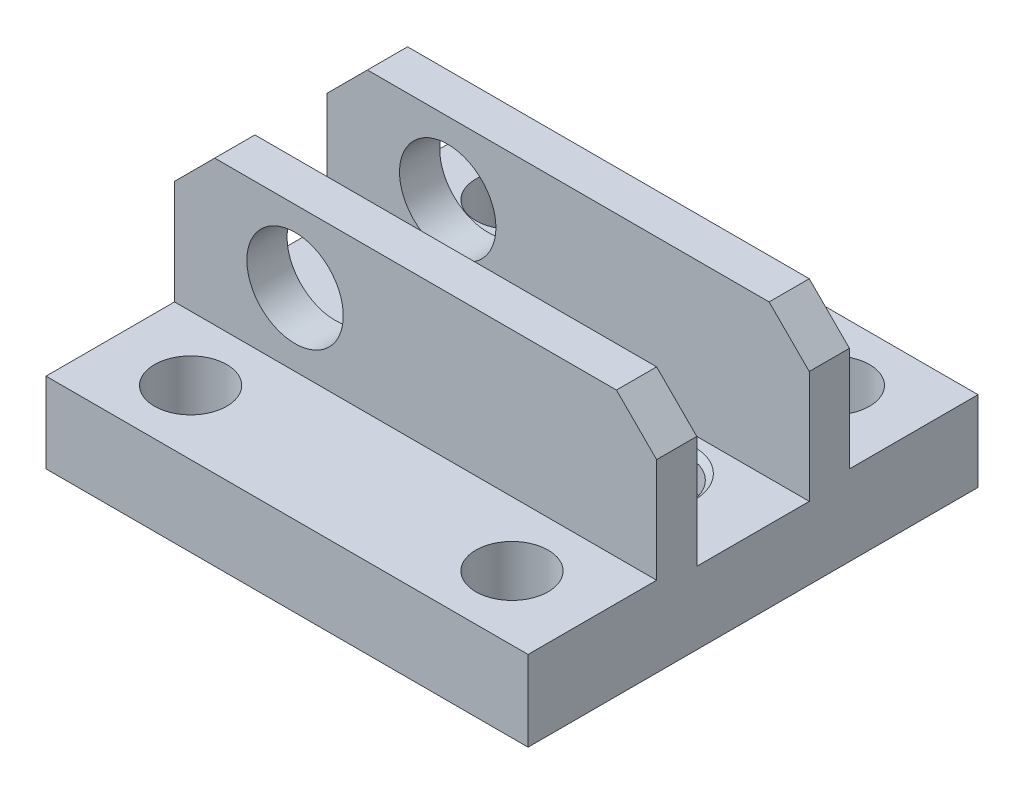
from build123d import *

# Parameters (mm, degrees)
BOSS_EXTRUDE1_DEPTH      = 14
BOSS_EXTRUDE1_DEPTH_BACK = 14
CUT_EXTRUDE1_DEPTH       = 14
CUT_EXTRUDE1_DEPTH_BACK  = 14
SKETCH2_R                = 3
CUT_EXTRUDE2_DEPTH       = 3.5
CUT_EXTRUDE2_DEPTH_BACK  = 3.5
SKETCH3_W                = 30
SKETCH3_H                = 9.5
SKETCH5_W                = 56
SKETCH5_H                = 28
CUT_EXTRUDE3_DEPTH       = 30
SKETCH6_R                = 2.25
CUT_EXTRUDE4_DEPTH       = 5
SKETCH7_R                = 2.25
CUT_EXTRUDE5_DEPTH       = 5
SKETCH8_R                = 2.25
CUT_EXTRUDE6_DEPTH       = 5
SKETCH9_R                = 2.25
CUT_EXTRUDE7_DEPTH       = 5


with BuildPart() as part:
    # Sketch1 → Boss-Extrude1 (new, two sides: drawn at the far end of the back side and taken through both)
    with BuildSketch(Plane.XY.offset(-BOSS_EXTRUDE1_DEPTH_BACK)):
        Polygon((0, 11.5), (0, 0), (30, 0), (30, 11.5), (27.5, 14), (2.5, 14), align=None)
    extrude(amount=BOSS_EXTRUDE1_DEPTH + BOSS_EXTRUDE1_DEPTH_BACK)

    # Sketch2 → Cut-Extrude1 (cut, two sides: drawn at the far end of the back side and taken through both)
    with BuildSketch(Plane.XY.offset(-CUT_EXTRUDE1_DEPTH_BACK)):
        with Locations((7.5, 9.5)):
            Circle(SKETCH2_R)
    extrude(amount=CUT_EXTRUDE1_DEPTH + CUT_EXTRUDE1_DEPTH_BACK, mode=Mode.SUBTRACT)

    # Sketch3 → Cut-Extrude2 (cut, two sides: drawn at the far end of the back side and taken through both)
    with BuildSketch(Plane.XY.offset(-CUT_EXTRUDE2_DEPTH_BACK)):
        with Locations((15, 9.25)):
            Rectangle(SKETCH3_W, SKETCH3_H)
    extrude(amount=CUT_EXTRUDE2_DEPTH + CUT_EXTRUDE2_DEPTH_BACK, mode=Mode.SUBTRACT)

    # Sketch4 → Cut-Revolve1 (revolve, cut)
    with BuildSketch(Plane.XY):
        Polygon((23.5, 4.5), (26.353553391, 4.5), (26, 4.146446609), (26, 2.5), (23.5, 2.5), align=None)
    revolve(axis=Axis((23.5, 2.5, 0), (0, 1, 0)), mode=Mode.SUBTRACT)

    # Sketch5 → Cut-Extrude3 (cut)
    with BuildSketch(Plane(origin=(0, 0, 0), x_dir=(0, 0, -1), z_dir=(1, 0, 0))):
        with Locations((0, 12)):
            Rectangle(SKETCH5_W, SKETCH5_H)
        Polygon((-14, 5), (-14, 0), (14, 0), (14, 5), (6, 5), (6, 14), (-6, 14), (-6, 5), align=None, mode=Mode.SUBTRACT)
    extrude(amount=CUT_EXTRUDE3_DEPTH, mode=Mode.SUBTRACT)

    # Sketch6 → Cut-Extrude4 (cut)
    with BuildSketch(Plane(origin=(0, 0, 0), x_dir=(1, 0, 0), z_dir=(0, 1, 0))):
        with Locations((5, -10)):
            Circle(SKETCH6_R)
    extrude(amount=CUT_EXTRUDE4_DEPTH, mode=Mode.SUBTRACT)

    # Sketch7 → Cut-Extrude5 (cut)
    with BuildSketch(Plane(origin=(0, 0, 0), x_dir=(1, 0, 0), z_dir=(0, 1, 0))):
        with Locations((25, 10)):
            Circle(SKETCH7_R)
    extrude(amount=CUT_EXTRUDE5_DEPTH, mode=Mode.SUBTRACT)

    # Sketch8 → Cut-Extrude6 (cut)
    with BuildSketch(Plane(origin=(0, 0, 0), x_dir=(1, 0, 0), z_dir=(0, 1, 0))):
        with Locations((25, -10)):
            Circle(SKETCH8_R)
    extrude(amount=CUT_EXTRUDE6_DEPTH, mode=Mode.SUBTRACT)

    # Sketch9 → Cut-Extrude7 (cut)
    with BuildSketch(Plane(origin=(0, 0, 0), x_dir=(1, 0, 0), z_dir=(0, 1, 0))):
        with Locations((5, 10)):
            Circle(SKETCH9_R)
    extrude(amount=CUT_EXTRUDE7_DEPTH, mode=Mode.SUBTRACT)


solid = part.part
